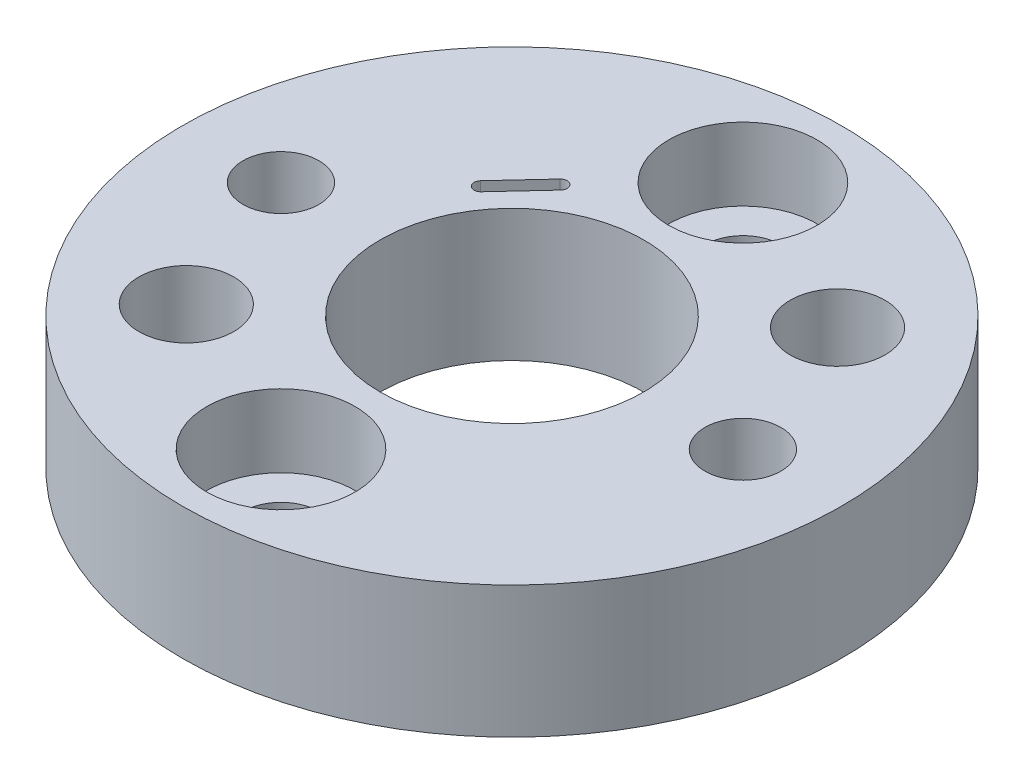
from build123d import *

# Parameters (mm, degrees)
SKETCH1_R                                      = 15.875
BOSS_EXTRUDE1_DEPTH                            = 6.35
SKETCH2_R                                      = 6.35
CUT_EXTRUDE1_DEPTH                             = 24.3313898
SKETCH11_R                                     = 2.286
CUT_EXTRUDE2_DEPTH                             = 24.3313898
CIRPATTERN3_COUNT                              = 2
CUT_EXTRUDE3_DEPTH                             = 24.3313898
CBORE_FOR_6_SOCKET_HEAD_CAP_SCREW2_D           = 3.6576
CBORE_FOR_6_SOCKET_HEAD_CAP_SCREW2_CBORE_D     = 7.14502
CBORE_FOR_6_SOCKET_HEAD_CAP_SCREW2_CBORE_DEPTH = 3.5052
CBORE_FOR_6_SOCKET_HEAD_CAP_SCREW1_D           = 3.6576
CBORE_FOR_6_SOCKET_HEAD_CAP_SCREW1_CBORE_D     = 7.14502
CBORE_FOR_6_SOCKET_HEAD_CAP_SCREW1_CBORE_DEPTH = 3.5052
CIRPATTERN5_COUNT                              = 2
CIRPATTERN6_COUNT                              = 2


with BuildPart() as part:
    # Sketch1 → Boss-Extrude1 (new body)
    with BuildSketch(Plane(origin=(0, 0, 0), x_dir=(1, 0, 0), z_dir=(0, 1, 0))):
        with Locations(Location((0, 0, 0), (0, 0, 270))):
            Circle(SKETCH1_R)
    extrude(amount=BOSS_EXTRUDE1_DEPTH)

    # Sketch2 → Cut-Extrude1 (cut, through all)
    with BuildSketch(Plane(origin=(0, 6.35, 0), x_dir=(1, 0, 0), z_dir=(0, 1, 0))):
        with Locations(Location((0, 0, 0), (0, 0, 270))):
            Circle(SKETCH2_R)
    extrude(amount=-CUT_EXTRUDE1_DEPTH, mode=Mode.SUBTRACT)

    # Sketch11 → Cut-Extrude2 (cut, through all)
    with BuildSketch(Plane(origin=(0, 6.35, 0), x_dir=(1, 0, 0), z_dir=(0, 1, 0))):
        with Locations(Location((8.328911597, 7.35641814, 0), (0, 0, 270))):
            Circle(SKETCH11_R)
    cut_extrude2 = extrude(amount=-CUT_EXTRUDE2_DEPTH, mode=Mode.SUBTRACT)

    # CirPattern3: Cut-Extrude2 ×2 about axis
    cirpattern3_axis = Axis((0, 0, 0), (0, 1, 0))
    for i in range(1, CIRPATTERN3_COUNT):
        add(cut_extrude2.rotate(cirpattern3_axis, i * 360 / CIRPATTERN3_COUNT), mode=Mode.SUBTRACT)

    # Sketch12 → Cut-Extrude3 (cut, through all)
    with BuildSketch(Plane(origin=(0, 6.35, 0), x_dir=(1, 0, 0), z_dir=(0, 1, 0))):
        with BuildLine():
            Line((-6.39758264, 4.883452605), (-4.554151289, 6.87011727))
            ThreePointArc((-4.554151289, 6.87011727), (-4.0916663, 6.887412726), (-4.074370844, 6.424927737))
            Line((-4.074370844, 6.424927737), (-5.917802195, 4.438263073))
            ThreePointArc((-5.917802195, 4.438263073), (-6.380287183, 4.420967617), (-6.39758264, 4.883452605))
        make_face()
    extrude(amount=-CUT_EXTRUDE3_DEPTH, mode=Mode.SUBTRACT)

    # CBORE for #6 Socket Head Cap Screw2 (through all)
    with Locations(Plane(origin=(11.1252, 0, 0), x_dir=(0, 0, -1), z_dir=(0, -1, 0))):
        with Locations((0, 0)):
            cbore_for_6_socket_head_cap_screw2 = CounterBoreHole(CBORE_FOR_6_SOCKET_HEAD_CAP_SCREW2_D / 2, CBORE_FOR_6_SOCKET_HEAD_CAP_SCREW2_CBORE_D / 2, CBORE_FOR_6_SOCKET_HEAD_CAP_SCREW2_CBORE_DEPTH)

    # CBORE for #6 Socket Head Cap Screw1 (through all)
    with Locations(Plane(origin=(0, 6.35, -11.1252), x_dir=(0, 0, 1), z_dir=(0, 1, 0))):
        with Locations((0, 0)):
            cbore_for_6_socket_head_cap_screw1 = CounterBoreHole(CBORE_FOR_6_SOCKET_HEAD_CAP_SCREW1_D / 2, CBORE_FOR_6_SOCKET_HEAD_CAP_SCREW1_CBORE_D / 2, CBORE_FOR_6_SOCKET_HEAD_CAP_SCREW1_CBORE_DEPTH)

    # CirPattern5: CBORE for #6 Socket Head Cap Screw1 ×2 about axis
    cirpattern5_axis = Axis((0, 0, 0), (0, 1, 0))
    for i in range(1, CIRPATTERN5_COUNT):
        add(cbore_for_6_socket_head_cap_screw1.rotate(cirpattern5_axis, i * 360 / CIRPATTERN5_COUNT), mode=Mode.SUBTRACT)

    # CirPattern6: CBORE for #6 Socket Head Cap Screw2 ×2 about axis
    cirpattern6_axis = Axis((0, 0, 0), (0, 1, 0))
    for i in range(1, CIRPATTERN6_COUNT):
        add(cbore_for_6_socket_head_cap_screw2.rotate(cirpattern6_axis, i * 360 / CIRPATTERN6_COUNT), mode=Mode.SUBTRACT)


solid = part.part
